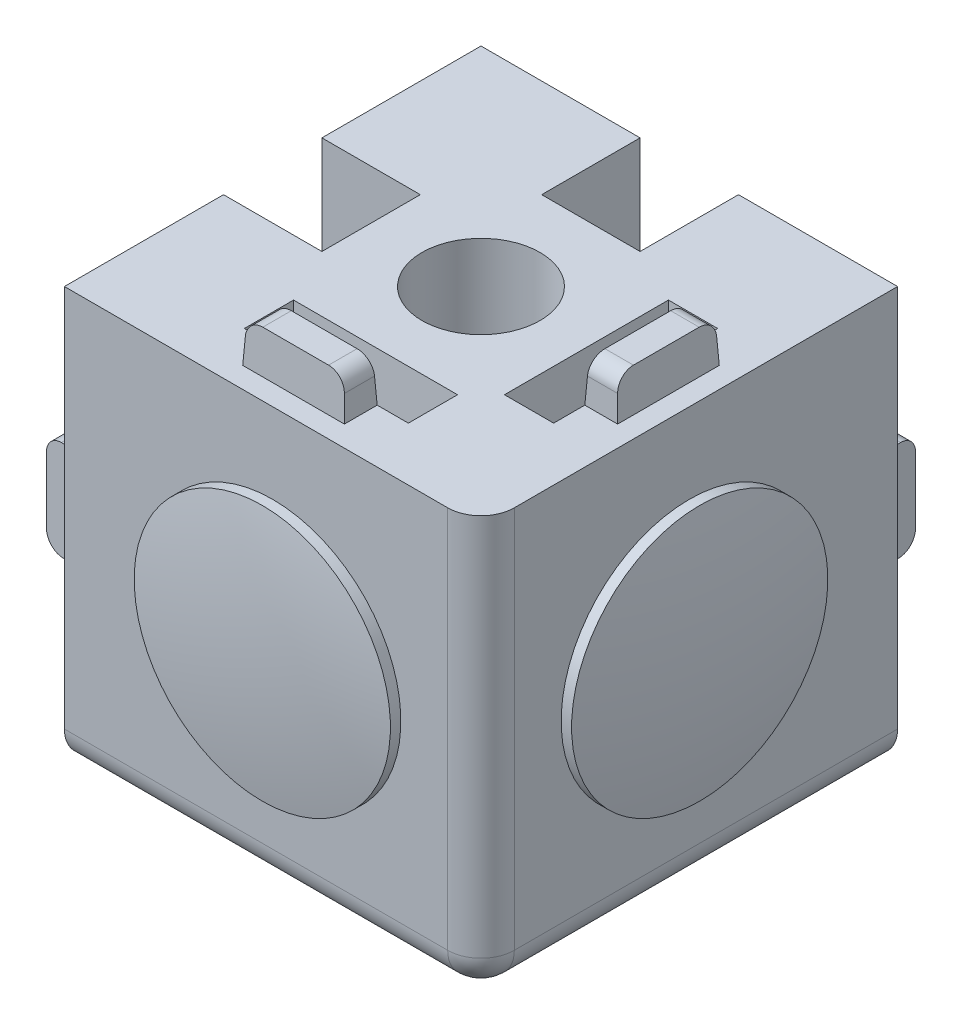
from build123d import *

# Parameters (mm, degrees)
SKETCH1_W                    = 25.4
SKETCH1_H                    = 25.4
EXTRUDE1_DEPTH               = 12.7
SKETCH2_R                    = 6
CUT_EXTRUDE1_DEPTH           = 32.108519733
EXTRUDE2_START               = -6
SKETCH4_R                    = 6
SKETCH4_R_2                  = 3.6
EXTRUDE2_DEPTH               = 6
SKETCH5_W                    = 6
SKETCH5_H                    = 6
CUT_EXTRUDE3_DEPTH           = 3
SKETCH6_W                    = 2
SKETCH6_H                    = 6.2
EXTRUDE3_DEPTH               = 2.5
EXTRUDE3_DRAFT               = 3
SKETCH6_W_2                  = 6.2
SKETCH6_H_2                  = 2
EXTRUDE3_PROFILE_2_DEPTH     = 2.5
EXTRUDE3_PROFILE_2_DRAFT     = 3
FILLET1_R                    = 1.016
SKETCH8_W                    = 3
SKETCH8_H                    = 10
CUT_EXTRUDE4_DEPTH           = 5
CUT_EXTRUDE4_DRAFT           = -3
SKETCH8_W_2                  = 10
SKETCH8_H_2                  = 3
CUT_EXTRUDE4_PROFILE_2_DEPTH = 5
CUT_EXTRUDE4_PROFILE_2_DRAFT = -3
CIRPATTERN1_COUNT            = 2
CIRPATTERN1_ANGLE            = 90
CIRPATTERN2_COUNT            = 2
CIRPATTERN2_ANGLE            = 90
MIRROR1_COPY_1_SKETCH_W      = 2
MIRROR1_COPY_1_SKETCH_H      = 6.2
MIRROR1_COPY_1_DEPTH         = 2.5
MIRROR1_COPY_1_DRAFT         = 3
MIRROR1_COPY_2_SKETCH_W      = 6.2
MIRROR1_COPY_2_SKETCH_H      = 2
MIRROR1_COPY_2_DEPTH         = 2.5
MIRROR1_COPY_2_DRAFT         = 3
MIRROR1_COPY_3_SKETCH_W      = 6.2
MIRROR1_COPY_3_SKETCH_H      = 2
MIRROR1_COPY_3_DEPTH         = 2.5
MIRROR1_COPY_3_DRAFT         = 3
MIRROR1_COPY_4_SKETCH_W      = 3
MIRROR1_COPY_4_SKETCH_H      = 10
MIRROR1_COPY_4_DEPTH         = 5
MIRROR1_COPY_4_DRAFT         = -3
MIRROR1_COPY_5_SKETCH_W      = 10
MIRROR1_COPY_5_SKETCH_H      = 3
MIRROR1_COPY_5_DEPTH         = 5
MIRROR1_COPY_5_DRAFT         = -3
MIRROR1_COPY_6_SKETCH_W      = 10
MIRROR1_COPY_6_SKETCH_H      = 3
MIRROR1_COPY_6_DEPTH         = 5
MIRROR1_COPY_6_DRAFT         = -3
FILLET1_OF_MIRROR1_R         = 1.016
MIRROR2_COPY_1_SKETCH_W      = 2
MIRROR2_COPY_1_SKETCH_H      = 6.2
MIRROR2_COPY_1_DEPTH         = 2.5
MIRROR2_COPY_1_DRAFT         = 3
MIRROR2_COPY_2_SKETCH_W      = 6.2
MIRROR2_COPY_2_SKETCH_H      = 2
MIRROR2_COPY_2_DEPTH         = 2.5
MIRROR2_COPY_2_DRAFT         = 3
MIRROR2_COPY_3_SKETCH_W      = 6.2
MIRROR2_COPY_3_SKETCH_H      = 2
MIRROR2_COPY_3_DEPTH         = 2.5
MIRROR2_COPY_3_DRAFT         = 3
MIRROR2_COPY_4_SKETCH_W      = 3
MIRROR2_COPY_4_SKETCH_H      = 10
MIRROR2_COPY_4_DEPTH         = 5
MIRROR2_COPY_4_DRAFT         = -3
MIRROR2_COPY_5_SKETCH_W      = 10
MIRROR2_COPY_5_SKETCH_H      = 3
MIRROR2_COPY_5_DEPTH         = 5
MIRROR2_COPY_5_DRAFT         = -3
MIRROR2_COPY_6_SKETCH_W      = 10
MIRROR2_COPY_6_SKETCH_H      = 3
MIRROR2_COPY_6_DEPTH         = 5
MIRROR2_COPY_6_DRAFT         = -3
FILLET1_OF_MIRROR2_R         = 1.016
SKETCH10_W                   = 6
SKETCH10_H                   = 6
CUT_EXTRUDE5_DEPTH           = 3
FILLET2_R                    = 2.032


with BuildPart() as part:
    # Sketch1 → Extrude1 (new, symmetric)
    with BuildSketch(Plane.XY):
        Rectangle(SKETCH1_W, SKETCH1_H)
    extrude(amount=EXTRUDE1_DEPTH, both=True)

    # Sketch2 → Cut-Extrude1 (cut, through all)
    with BuildSketch(Plane.XY.offset(12.7)):
        Circle(SKETCH2_R)
    cut_extrude1 = extrude(amount=-CUT_EXTRUDE1_DEPTH, mode=Mode.SUBTRACT)

    # Cut-Extrude2 cone 1 section (through the dimple's axis) → Cut-Extrude2 (revolve, cut)
    with BuildSketch(Plane(origin=(0, 0, 12.7), x_dir=(0, -1, 0), z_dir=(1, 0, 0))):
        Polygon((0, 0), (7.05, 0), (0, 7.05), align=None)
    cut_extrude2 = revolve(axis=Axis((0, 0, 12.7), (0, 0, -1)), mode=Mode.SUBTRACT)

    # Sketch4 → Extrude2 (add)
    with BuildSketch(Plane(origin=(0, 0, -12.7), x_dir=(-1, 0, 0), z_dir=(0, 0, -1)).offset(EXTRUDE2_START)):
        with Locations(Location((0, 0, 0), (0, 0, 180))):
            Circle(SKETCH4_R)
        Circle(SKETCH4_R_2, mode=Mode.SUBTRACT)
    extrude2 = extrude(amount=EXTRUDE2_DEPTH)

    # Sketch5 → Cut-Extrude3 (cut, symmetric)
    with BuildSketch(Plane(origin=(0, 0, 0), x_dir=(0, 0, -1), z_dir=(1, 0, 0))):
        with Locations((9.7, 9.7)):
            Rectangle(SKETCH5_W, SKETCH5_H)
    cut_extrude3 = extrude(amount=CUT_EXTRUDE3_DEPTH, both=True, mode=Mode.SUBTRACT)


with BuildPart() as extrude3_tool:
    # Sketch6 → Extrude3 (with draft: the straight prism first)
    with BuildSketch(Plane(origin=(0, 0, -12.7), x_dir=(-1, 0, 0), z_dir=(0, 0, -1))):
        with Locations((-10.43, 0)):
            Rectangle(SKETCH6_W, SKETCH6_H)
    extrude(amount=EXTRUDE3_DEPTH)
    # Extrude3: the draft: its side faces are tilted about the plane it starts from
    extrude3_sides = [extrude3_tool.faces().sort_by_distance(p)[0] for p in [
        (11.43, 0, -13.95),
        (10.43, -3.1, -13.95),
        (9.43, 0, -13.95),
        (10.43, 3.1, -13.95),
    ]]
    draft(extrude3_sides, Plane(origin=(0, 0, -12.7), x_dir=(-1, 0, 0), z_dir=(0, 0, -1)), EXTRUDE3_DRAFT)


with BuildPart() as part_1:
    add(part.part)

    # Extrude3: add extrude3_tool
    add(extrude3_tool.part)


with BuildPart() as extrude3_profile_2_tool:
    # Sketch6 → Extrude3 profile 2 (with draft: the straight prism first)
    with BuildSketch(Plane(origin=(0, 0, -12.7), x_dir=(-1, 0, 0), z_dir=(0, 0, -1))):
        with Locations((0, -10.43)):
            Rectangle(SKETCH6_W_2, SKETCH6_H_2)
    extrude(amount=EXTRUDE3_PROFILE_2_DEPTH)
    # Extrude3 profile 2: the draft: its side faces are tilted about the plane it starts from
    extrude3_profile_2_sides = [extrude3_profile_2_tool.faces().sort_by_distance(p)[0] for p in [
        (3.1, -10.43, -13.95),
        (0, -11.43, -13.95),
        (-3.1, -10.43, -13.95),
        (0, -9.43, -13.95),
    ]]
    draft(extrude3_profile_2_sides, Plane(origin=(0, 0, -12.7), x_dir=(-1, 0, 0), z_dir=(0, 0, -1)), EXTRUDE3_PROFILE_2_DRAFT)


with BuildPart() as part_2:
    add(part_1.part)

    # Extrude3 profile 2: add extrude3_profile_2_tool
    add(extrude3_profile_2_tool.part)

    # Fillet1
    fillet1_edges = [part_2.edges().sort_by_distance(p)[0] for p in [
        (10.43, -2.968980552, -15.2),
        (10.43, 2.968980552, -15.2),
        (2.968980552, -10.43, -15.2),
        (-2.968980552, -10.43, -15.2),
    ]]
    fillet(fillet1_edges, radius=FILLET1_R)


with BuildPart() as cut_extrude4_tool:
    # Sketch8 → Cut-Extrude4 (with draft: the straight prism first)
    with BuildSketch(Plane(origin=(0, 0, -12.7), x_dir=(-1, 0, 0), z_dir=(0, 0, -1))):
        with Locations((-7.93, 0)):
            Rectangle(SKETCH8_W, SKETCH8_H)
    extrude(amount=-CUT_EXTRUDE4_DEPTH)
    # Cut-Extrude4: the draft: its side faces are tilted about the plane it starts from
    cut_extrude4_sides = [cut_extrude4_tool.faces().sort_by_distance(p)[0] for p in [
        (9.43, 0, -10.2),
        (7.93, -5, -10.2),
        (6.43, 0, -10.2),
        (7.93, 5, -10.2),
    ]]
    draft(cut_extrude4_sides, Plane(origin=(0, 0, -12.7), x_dir=(-1, 0, 0), z_dir=(0, 0, -1)), CUT_EXTRUDE4_DRAFT)


with BuildPart() as part_3:
    add(part_2.part)

    # Cut-Extrude4: cut by cut_extrude4_tool
    add(cut_extrude4_tool.part, mode=Mode.SUBTRACT)


with BuildPart() as cut_extrude4_profile_2_tool:
    # Sketch8 → Cut-Extrude4 profile 2 (with draft: the straight prism first)
    with BuildSketch(Plane(origin=(0, 0, -12.7), x_dir=(-1, 0, 0), z_dir=(0, 0, -1))):
        with Locations((0, -7.93)):
            Rectangle(SKETCH8_W_2, SKETCH8_H_2)
    extrude(amount=-CUT_EXTRUDE4_PROFILE_2_DEPTH)
    # Cut-Extrude4 profile 2: the draft: its side faces are tilted about the plane it starts from
    cut_extrude4_profile_2_sides = [cut_extrude4_profile_2_tool.faces().sort_by_distance(p)[0] for p in [
        (5, -7.93, -10.2),
        (0, -9.43, -10.2),
        (-5, -7.93, -10.2),
        (0, -6.43, -10.2),
    ]]
    draft(cut_extrude4_profile_2_sides, Plane(origin=(0, 0, -12.7), x_dir=(-1, 0, 0), z_dir=(0, 0, -1)), CUT_EXTRUDE4_PROFILE_2_DRAFT)


with BuildPart() as part_4:
    add(part_3.part)

    # Cut-Extrude4 profile 2: cut by cut_extrude4_profile_2_tool
    add(cut_extrude4_profile_2_tool.part, mode=Mode.SUBTRACT)

    # CirPattern1: Cut-Extrude1, Cut-Extrude2, Extrude2 ×2 about axis
    cirpattern1_axis = Axis((-12.7, 0, 0), (1, 0, 0))
    add([cut_extrude1.rotate(cirpattern1_axis, i * CIRPATTERN1_ANGLE / (CIRPATTERN1_COUNT - 1)) for i in range(1, CIRPATTERN1_COUNT)], mode=Mode.SUBTRACT)
    add([cut_extrude2.rotate(cirpattern1_axis, i * CIRPATTERN1_ANGLE / (CIRPATTERN1_COUNT - 1)) for i in range(1, CIRPATTERN1_COUNT)], mode=Mode.SUBTRACT)
    add([extrude2.rotate(cirpattern1_axis, i * CIRPATTERN1_ANGLE / (CIRPATTERN1_COUNT - 1)) for i in range(1, CIRPATTERN1_COUNT)])

    # CirPattern2: Cut-Extrude1, Cut-Extrude2, Extrude2 ×2 about axis
    cirpattern2_axis = Axis((0, 11.593926757, 0), (0, 1, 0))
    add([cut_extrude1.rotate(cirpattern2_axis, i * CIRPATTERN2_ANGLE / (CIRPATTERN2_COUNT - 1)) for i in range(1, CIRPATTERN2_COUNT)], mode=Mode.SUBTRACT)
    add([cut_extrude2.rotate(cirpattern2_axis, i * CIRPATTERN2_ANGLE / (CIRPATTERN2_COUNT - 1)) for i in range(1, CIRPATTERN2_COUNT)], mode=Mode.SUBTRACT)
    add([extrude2.rotate(cirpattern2_axis, i * CIRPATTERN2_ANGLE / (CIRPATTERN2_COUNT - 1)) for i in range(1, CIRPATTERN2_COUNT)])


with BuildPart() as mirror1_copy_1_tool:
    # Mirror1 copy 1 sketch → Mirror1 copy 1 (with draft: the straight prism first)
    with BuildSketch(Plane(origin=(0, 12.7, 0), x_dir=(-1, 0, 0), z_dir=(0, 1, 0))):
        with Locations((-10.43, 0)):
            Rectangle(MIRROR1_COPY_1_SKETCH_W, MIRROR1_COPY_1_SKETCH_H)
    extrude(amount=MIRROR1_COPY_1_DEPTH)
    # Mirror1 copy 1: the draft: its side faces are tilted about the plane it starts from
    mirror1_copy_1_sides = [mirror1_copy_1_tool.faces().sort_by_distance(p)[0] for p in [
        (11.43, 13.95, 0),
        (10.43, 13.95, 3.1),
        (9.43, 13.95, 0),
        (10.43, 13.95, -3.1),
    ]]
    draft(mirror1_copy_1_sides, Plane(origin=(0, 12.7, 0), x_dir=(-1, 0, 0), z_dir=(0, 1, 0)), MIRROR1_COPY_1_DRAFT)


with BuildPart() as part_5:
    add(part_4.part)

    # Mirror1 copy 1: add mirror1_copy_1_tool
    add(mirror1_copy_1_tool.part)


with BuildPart() as mirror1_copy_2_tool:
    # Mirror1 copy 2 sketch → Mirror1 copy 2 (with draft: the straight prism first)
    with BuildSketch(Plane(origin=(0, 12.7, 0), x_dir=(-1, 0, 0), z_dir=(0, 1, 0))):
        with Locations((0, 10.43)):
            Rectangle(MIRROR1_COPY_2_SKETCH_W, MIRROR1_COPY_2_SKETCH_H)
    extrude(amount=MIRROR1_COPY_2_DEPTH)
    # Mirror1 copy 2: the draft: its side faces are tilted about the plane it starts from
    mirror1_copy_2_sides = [mirror1_copy_2_tool.faces().sort_by_distance(p)[0] for p in [
        (3.1, 13.95, 10.43),
        (0, 13.95, 11.43),
        (-3.1, 13.95, 10.43),
        (0, 13.95, 9.43),
    ]]
    draft(mirror1_copy_2_sides, Plane(origin=(0, 12.7, 0), x_dir=(-1, 0, 0), z_dir=(0, 1, 0)), MIRROR1_COPY_2_DRAFT)


with BuildPart() as part_6:
    add(part_5.part)

    # Mirror1 copy 2: add mirror1_copy_2_tool
    add(mirror1_copy_2_tool.part)


with BuildPart() as mirror1_copy_3_tool:
    # Mirror1 copy 3 sketch → Mirror1 copy 3 (with draft: the straight prism first)
    with BuildSketch(Plane(origin=(0, 12.7, 0), x_dir=(-1, 0, 0), z_dir=(0, 1, 0))):
        with Locations((0, 10.43)):
            Rectangle(MIRROR1_COPY_3_SKETCH_W, MIRROR1_COPY_3_SKETCH_H)
    extrude(amount=MIRROR1_COPY_3_DEPTH)
    # Mirror1 copy 3: the draft: its side faces are tilted about the plane it starts from
    mirror1_copy_3_sides = [mirror1_copy_3_tool.faces().sort_by_distance(p)[0] for p in [
        (3.1, 13.95, 10.43),
        (0, 13.95, 11.43),
        (-3.1, 13.95, 10.43),
        (0, 13.95, 9.43),
    ]]
    draft(mirror1_copy_3_sides, Plane(origin=(0, 12.7, 0), x_dir=(-1, 0, 0), z_dir=(0, 1, 0)), MIRROR1_COPY_3_DRAFT)


with BuildPart() as part_7:
    add(part_6.part)

    # Mirror1 copy 3: add mirror1_copy_3_tool
    add(mirror1_copy_3_tool.part)


with BuildPart() as mirror1_copy_4_tool:
    # Mirror1 copy 4 sketch → Mirror1 copy 4 (with draft: the straight prism first)
    with BuildSketch(Plane(origin=(0, 12.7, 0), x_dir=(-1, 0, 0), z_dir=(0, 1, 0))):
        with Locations((-7.93, 0)):
            Rectangle(MIRROR1_COPY_4_SKETCH_W, MIRROR1_COPY_4_SKETCH_H)
    extrude(amount=-MIRROR1_COPY_4_DEPTH)
    # Mirror1 copy 4: the draft: its side faces are tilted about the plane it starts from
    mirror1_copy_4_sides = [mirror1_copy_4_tool.faces().sort_by_distance(p)[0] for p in [
        (9.43, 10.2, 0),
        (7.93, 10.2, 5),
        (6.43, 10.2, 0),
        (7.93, 10.2, -5),
    ]]
    draft(mirror1_copy_4_sides, Plane(origin=(0, 12.7, 0), x_dir=(-1, 0, 0), z_dir=(0, 1, 0)), MIRROR1_COPY_4_DRAFT)


with BuildPart() as part_8:
    add(part_7.part)

    # Mirror1 copy 4: cut by mirror1_copy_4_tool
    add(mirror1_copy_4_tool.part, mode=Mode.SUBTRACT)


with BuildPart() as mirror1_copy_5_tool:
    # Mirror1 copy 5 sketch → Mirror1 copy 5 (with draft: the straight prism first)
    with BuildSketch(Plane(origin=(0, 12.7, 0), x_dir=(-1, 0, 0), z_dir=(0, 1, 0))):
        with Locations((0, 7.93)):
            Rectangle(MIRROR1_COPY_5_SKETCH_W, MIRROR1_COPY_5_SKETCH_H)
    extrude(amount=-MIRROR1_COPY_5_DEPTH)
    # Mirror1 copy 5: the draft: its side faces are tilted about the plane it starts from
    mirror1_copy_5_sides = [mirror1_copy_5_tool.faces().sort_by_distance(p)[0] for p in [
        (5, 10.2, 7.93),
        (0, 10.2, 9.43),
        (-5, 10.2, 7.93),
        (0, 10.2, 6.43),
    ]]
    draft(mirror1_copy_5_sides, Plane(origin=(0, 12.7, 0), x_dir=(-1, 0, 0), z_dir=(0, 1, 0)), MIRROR1_COPY_5_DRAFT)


with BuildPart() as part_9:
    add(part_8.part)

    # Mirror1 copy 5: cut by mirror1_copy_5_tool
    add(mirror1_copy_5_tool.part, mode=Mode.SUBTRACT)


with BuildPart() as mirror1_copy_6_tool:
    # Mirror1 copy 6 sketch → Mirror1 copy 6 (with draft: the straight prism first)
    with BuildSketch(Plane(origin=(0, 12.7, 0), x_dir=(-1, 0, 0), z_dir=(0, 1, 0))):
        with Locations((0, 7.93)):
            Rectangle(MIRROR1_COPY_6_SKETCH_W, MIRROR1_COPY_6_SKETCH_H)
    extrude(amount=-MIRROR1_COPY_6_DEPTH)
    # Mirror1 copy 6: the draft: its side faces are tilted about the plane it starts from
    mirror1_copy_6_sides = [mirror1_copy_6_tool.faces().sort_by_distance(p)[0] for p in [
        (5, 10.2, 7.93),
        (0, 10.2, 9.43),
        (-5, 10.2, 7.93),
        (0, 10.2, 6.43),
    ]]
    draft(mirror1_copy_6_sides, Plane(origin=(0, 12.7, 0), x_dir=(-1, 0, 0), z_dir=(0, 1, 0)), MIRROR1_COPY_6_DRAFT)


with BuildPart() as part_10:
    add(part_9.part)

    # Mirror1 copy 6: cut by mirror1_copy_6_tool
    add(mirror1_copy_6_tool.part, mode=Mode.SUBTRACT)

    # Fillet1 of Mirror1
    fillet1_of_mirror1_edges = [part_10.edges().sort_by_distance(p)[0] for p in [
        (10.43, 15.2, 2.968980552),
        (10.43, 15.2, -2.968980552),
        (2.968980552, 15.2, 10.43),
        (-2.968980552, 15.2, 10.43),
    ]]
    fillet(fillet1_of_mirror1_edges, radius=FILLET1_OF_MIRROR1_R)

    # Mirror2: Cut-Extrude3 across plane
    add(cut_extrude3.mirror(Plane(origin=(0, 0, 0), x_dir=(0.7071067811865488, 0, 0.7071067811865464), z_dir=(0.7071067811865462, 0, -0.7071067811865488))), mode=Mode.SUBTRACT)


with BuildPart() as mirror2_copy_1_tool:
    # Mirror2 copy 1 sketch → Mirror2 copy 1 (with draft: the straight prism first)
    with BuildSketch(Plane(origin=(-12.7, 0, 0), x_dir=(0, 0, -1), z_dir=(-1, 0, 0))):
        with Locations((-10.43, 0)):
            Rectangle(MIRROR2_COPY_1_SKETCH_W, MIRROR2_COPY_1_SKETCH_H)
    extrude(amount=MIRROR2_COPY_1_DEPTH)
    # Mirror2 copy 1: the draft: its side faces are tilted about the plane it starts from
    mirror2_copy_1_sides = [mirror2_copy_1_tool.faces().sort_by_distance(p)[0] for p in [
        (-13.95, 0, 11.43),
        (-13.95, -3.1, 10.43),
        (-13.95, 0, 9.43),
        (-13.95, 3.1, 10.43),
    ]]
    draft(mirror2_copy_1_sides, Plane(origin=(-12.7, 0, 0), x_dir=(0, 0, -1), z_dir=(-1, 0, 0)), MIRROR2_COPY_1_DRAFT)


with BuildPart() as part_11:
    add(part_10.part)

    # Mirror2 copy 1: add mirror2_copy_1_tool
    add(mirror2_copy_1_tool.part)


with BuildPart() as mirror2_copy_2_tool:
    # Mirror2 copy 2 sketch → Mirror2 copy 2 (with draft: the straight prism first)
    with BuildSketch(Plane(origin=(-12.7, 0, 0), x_dir=(0, 0, -1), z_dir=(-1, 0, 0))):
        with Locations((0, 10.43)):
            Rectangle(MIRROR2_COPY_2_SKETCH_W, MIRROR2_COPY_2_SKETCH_H)
    extrude(amount=MIRROR2_COPY_2_DEPTH)
    # Mirror2 copy 2: the draft: its side faces are tilted about the plane it starts from
    mirror2_copy_2_sides = [mirror2_copy_2_tool.faces().sort_by_distance(p)[0] for p in [
        (-13.95, -10.43, 3.1),
        (-13.95, -11.43, 0),
        (-13.95, -10.43, -3.1),
        (-13.95, -9.43, 0),
    ]]
    draft(mirror2_copy_2_sides, Plane(origin=(-12.7, 0, 0), x_dir=(0, 0, -1), z_dir=(-1, 0, 0)), MIRROR2_COPY_2_DRAFT)


with BuildPart() as part_12:
    add(part_11.part)

    # Mirror2 copy 2: add mirror2_copy_2_tool
    add(mirror2_copy_2_tool.part)


with BuildPart() as mirror2_copy_3_tool:
    # Mirror2 copy 3 sketch → Mirror2 copy 3 (with draft: the straight prism first)
    with BuildSketch(Plane(origin=(-12.7, 0, 0), x_dir=(0, 0, -1), z_dir=(-1, 0, 0))):
        with Locations((0, 10.43)):
            Rectangle(MIRROR2_COPY_3_SKETCH_W, MIRROR2_COPY_3_SKETCH_H)
    extrude(amount=MIRROR2_COPY_3_DEPTH)
    # Mirror2 copy 3: the draft: its side faces are tilted about the plane it starts from
    mirror2_copy_3_sides = [mirror2_copy_3_tool.faces().sort_by_distance(p)[0] for p in [
        (-13.95, -10.43, 3.1),
        (-13.95, -11.43, 0),
        (-13.95, -10.43, -3.1),
        (-13.95, -9.43, 0),
    ]]
    draft(mirror2_copy_3_sides, Plane(origin=(-12.7, 0, 0), x_dir=(0, 0, -1), z_dir=(-1, 0, 0)), MIRROR2_COPY_3_DRAFT)


with BuildPart() as part_13:
    add(part_12.part)

    # Mirror2 copy 3: add mirror2_copy_3_tool
    add(mirror2_copy_3_tool.part)


with BuildPart() as mirror2_copy_4_tool:
    # Mirror2 copy 4 sketch → Mirror2 copy 4 (with draft: the straight prism first)
    with BuildSketch(Plane(origin=(-12.7, 0, 0), x_dir=(0, 0, -1), z_dir=(-1, 0, 0))):
        with Locations((-7.93, 0)):
            Rectangle(MIRROR2_COPY_4_SKETCH_W, MIRROR2_COPY_4_SKETCH_H)
    extrude(amount=-MIRROR2_COPY_4_DEPTH)
    # Mirror2 copy 4: the draft: its side faces are tilted about the plane it starts from
    mirror2_copy_4_sides = [mirror2_copy_4_tool.faces().sort_by_distance(p)[0] for p in [
        (-10.2, 0, 9.43),
        (-10.2, -5, 7.93),
        (-10.2, 0, 6.43),
        (-10.2, 5, 7.93),
    ]]
    draft(mirror2_copy_4_sides, Plane(origin=(-12.7, 0, 0), x_dir=(0, 0, -1), z_dir=(-1, 0, 0)), MIRROR2_COPY_4_DRAFT)


with BuildPart() as part_14:
    add(part_13.part)

    # Mirror2 copy 4: cut by mirror2_copy_4_tool
    add(mirror2_copy_4_tool.part, mode=Mode.SUBTRACT)


with BuildPart() as mirror2_copy_5_tool:
    # Mirror2 copy 5 sketch → Mirror2 copy 5 (with draft: the straight prism first)
    with BuildSketch(Plane(origin=(-12.7, 0, 0), x_dir=(0, 0, -1), z_dir=(-1, 0, 0))):
        with Locations((0, 7.93)):
            Rectangle(MIRROR2_COPY_5_SKETCH_W, MIRROR2_COPY_5_SKETCH_H)
    extrude(amount=-MIRROR2_COPY_5_DEPTH)
    # Mirror2 copy 5: the draft: its side faces are tilted about the plane it starts from
    mirror2_copy_5_sides = [mirror2_copy_5_tool.faces().sort_by_distance(p)[0] for p in [
        (-10.2, -7.93, 5),
        (-10.2, -9.43, 0),
        (-10.2, -7.93, -5),
        (-10.2, -6.43, 0),
    ]]
    draft(mirror2_copy_5_sides, Plane(origin=(-12.7, 0, 0), x_dir=(0, 0, -1), z_dir=(-1, 0, 0)), MIRROR2_COPY_5_DRAFT)


with BuildPart() as part_15:
    add(part_14.part)

    # Mirror2 copy 5: cut by mirror2_copy_5_tool
    add(mirror2_copy_5_tool.part, mode=Mode.SUBTRACT)


with BuildPart() as mirror2_copy_6_tool:
    # Mirror2 copy 6 sketch → Mirror2 copy 6 (with draft: the straight prism first)
    with BuildSketch(Plane(origin=(-12.7, 0, 0), x_dir=(0, 0, -1), z_dir=(-1, 0, 0))):
        with Locations((0, 7.93)):
            Rectangle(MIRROR2_COPY_6_SKETCH_W, MIRROR2_COPY_6_SKETCH_H)
    extrude(amount=-MIRROR2_COPY_6_DEPTH)
    # Mirror2 copy 6: the draft: its side faces are tilted about the plane it starts from
    mirror2_copy_6_sides = [mirror2_copy_6_tool.faces().sort_by_distance(p)[0] for p in [
        (-10.2, -7.93, 5),
        (-10.2, -9.43, 0),
        (-10.2, -7.93, -5),
        (-10.2, -6.43, 0),
    ]]
    draft(mirror2_copy_6_sides, Plane(origin=(-12.7, 0, 0), x_dir=(0, 0, -1), z_dir=(-1, 0, 0)), MIRROR2_COPY_6_DRAFT)


with BuildPart() as part_16:
    add(part_15.part)

    # Mirror2 copy 6: cut by mirror2_copy_6_tool
    add(mirror2_copy_6_tool.part, mode=Mode.SUBTRACT)

    # Fillet1 of Mirror2
    fillet1_of_mirror2_edges = [part_16.edges().sort_by_distance(p)[0] for p in [
        (-15.2, -2.968980552, 10.43),
        (-15.2, 2.968980552, 10.43),
        (-15.2, -10.43, 2.968980552),
        (-15.2, -10.43, -2.968980552),
    ]]
    fillet(fillet1_of_mirror2_edges, radius=FILLET1_OF_MIRROR2_R)

    # Sketch10 → Cut-Extrude5 (cut, symmetric)
    with BuildSketch(Plane(origin=(0, 0, 0), x_dir=(1, 0, 0), z_dir=(0, 1, 0))):
        with Locations((-9.7, 9.7)):
            Rectangle(SKETCH10_W, SKETCH10_H)
    extrude(amount=CUT_EXTRUDE5_DEPTH, both=True, mode=Mode.SUBTRACT)

    # Fillet2
    fillet2_edges = [part_16.edges().sort_by_distance(p)[0] for p in [
        (12.7, 0, 12.7),
        (0, -12.7, 12.7),
        (12.7, -12.7, 0),
    ]]
    fillet(fillet2_edges, radius=FILLET2_R)


with BuildPart() as body_2:
    # Sketch11 → Revolve1 (revolve)
    with BuildSketch(Plane(origin=(0, 0, 0), x_dir=(0, 0, -1), z_dir=(1, 0, 0))):
        with BuildLine():
            Line((-13.335, 7.812), (-12.7, 7.812))
            Line((-12.7, 7.812), (-12.7, 5.9746))
            Line((-12.7, 5.9746), (-8.1026, 5.9746))
            Line((-8.1026, 5.9746), (-8.1026, 4.7046))
            Line((-8.1026, 4.7046), (-12.065, 4.7046))
            Line((-12.065, 4.7046), (-12.065, 0))
            Line((-12.065, 0), (-13.97, 0))
            ThreePointArc((-13.97, 0), (-13.810988636, 3.918882781), (-13.335, 7.812))
        make_face()
    revolve(axis=Axis((0, 0, 12.065), (0, 0, 1)))


with BuildPart() as body_3:
    # Mirror3: mirrored copy
    add(body_2.part.mirror(Plane(origin=(0, 0, 0), x_dir=(0, -0.7071067811865488, 0.7071067811865464), z_dir=(0, 0.7071067811865462, 0.7071067811865488))))


with BuildPart() as body_4:
    # Mirror4: mirrored copy
    add(body_2.part.mirror(Plane(origin=(0, 0, 0), x_dir=(0.7071067811865488, 0, 0.7071067811865464), z_dir=(0.7071067811865462, 0, -0.7071067811865488))))


solid = Compound([part_16.part, body_2.part, body_3.part, body_4.part])
